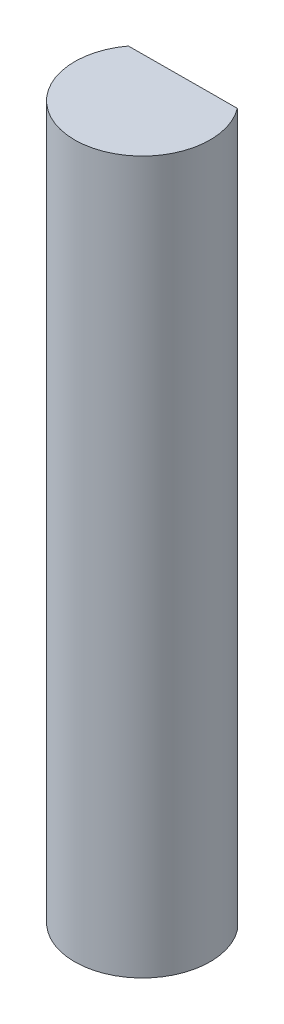
from build123d import *

# Parameters (mm, degrees)
SKETCH1_R           = 3.175
BOSS_EXTRUDE1_DEPTH = 16.66875
CUT_EXTRUDE5_DEPTH  = 34.638521909


with BuildPart() as part:
    # Sketch1 → Boss-Extrude1 (new, symmetric)
    with BuildSketch(Plane(origin=(0, 0, 0), x_dir=(1, 0, 0), z_dir=(0, 1, 0))):
        with Locations(Location((0, 0, 0), (0, 0, 270))):
            Circle(SKETCH1_R)
    extrude(amount=BOSS_EXTRUDE1_DEPTH, both=True)

    # Sketch2 → Cut-Extrude5 (cut, through all)
    with BuildSketch(Plane(origin=(0, 16.66875, 0), x_dir=(1, 0, 0), z_dir=(0, 1, 0))):
        with BuildLine():
            Line((-2.549322464, 1.892506268), (2.530677536, 1.917366999))
            ThreePointArc((2.530677536, 1.917366999), (-0.015537771, 3.174961981), (-2.549322464, 1.892506268))
        make_face()
    extrude(amount=-CUT_EXTRUDE5_DEPTH, mode=Mode.SUBTRACT)


solid = part.part
